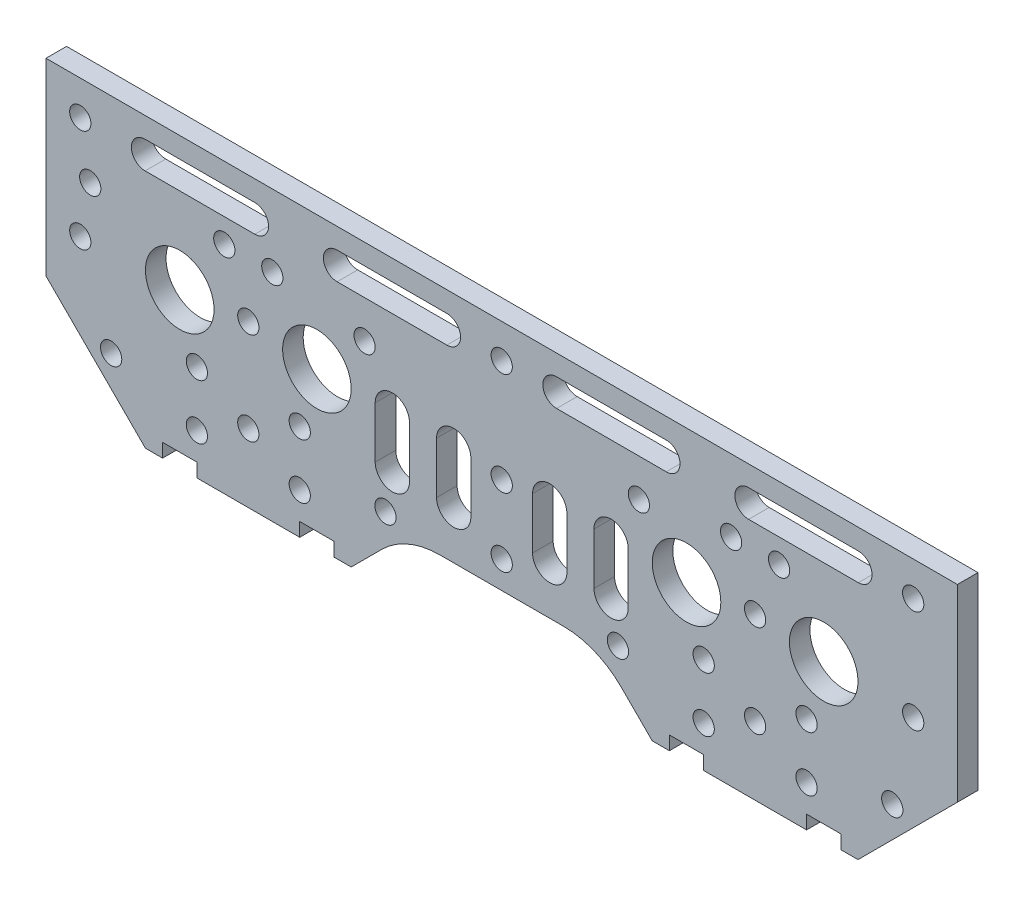
from build123d import *

# Parameters (mm, degrees)
SKETCH_1_R          = 1.55
SKETCH_1_R_2        = 5
EXTRUDE_1_DEPTH     = 3
FILLET_1_R          = 12
SKETCH_2_W          = 5
SKETCH_2_H          = 8
CUT_EXTRUDE_1_DEPTH = 10


with BuildPart() as part:
    # 草图1 → 凸台-拉伸1 (new body)
    with BuildSketch(Plane.XY):
        Polygon((-29.5, 32), (103.4, 32), (103.4, 7), (103.4, 4.5), (88.9, -10), (86.4, -10), (61.4, -10), (58.9, -10), (50.9, -2), (23, -2), (15, -10), (12.5, -10), (-12.5, -10), (-15, -10), (-29.5, 4.5), (-29.5, 7), align=None)
        with Locations((-7.5, 4)):
            Circle(SKETCH_1_R, mode=Mode.SUBTRACT)
        with Locations((-7.5, -4)):
            Circle(SKETCH_1_R, mode=Mode.SUBTRACT)
        with Locations((7.5, -4)):
            Circle(SKETCH_1_R, mode=Mode.SUBTRACT)
        with Locations((7.5, 4)):
            Circle(SKETCH_1_R, mode=Mode.SUBTRACT)
        with Locations((66.4, 4)):
            Circle(SKETCH_1_R, mode=Mode.SUBTRACT)
        with Locations((66.4, -4)):
            Circle(SKETCH_1_R, mode=Mode.SUBTRACT)
        with Locations((81.4, 4)):
            Circle(SKETCH_1_R, mode=Mode.SUBTRACT)
        with Locations((81.4, -4)):
            Circle(SKETCH_1_R, mode=Mode.SUBTRACT)
        with Locations((-24.5, 27)):
            Circle(SKETCH_1_R, mode=Mode.SUBTRACT)
        with Locations((-24.5, 12)):
            Circle(SKETCH_1_R, mode=Mode.SUBTRACT)
        with Locations((16.95, 19.5)):
            Circle(SKETCH_1_R, mode=Mode.SUBTRACT)
        with Locations((36.95, 27)):
            Circle(SKETCH_1_R, mode=Mode.SUBTRACT)
        with Locations((36.95, 12)):
            Circle(SKETCH_1_R, mode=Mode.SUBTRACT)
        with Locations((56.95, 19.5)):
            Circle(SKETCH_1_R, mode=Mode.SUBTRACT)
        with Locations((96.95, 27)):
            Circle(SKETCH_1_R, mode=Mode.SUBTRACT)
        with Locations((96.95, 12)):
            Circle(SKETCH_1_R, mode=Mode.SUBTRACT)
        with Locations((-23.05, 19.5)):
            Circle(SKETCH_1_R, mode=Mode.SUBTRACT)
        with Locations((36.95, 2)):
            Circle(SKETCH_1_R, mode=Mode.SUBTRACT)
        with Locations((73.9, 13.5)):
            Circle(SKETCH_1_R, mode=Mode.SUBTRACT)
        with Locations((70.4, 21.5)):
            Circle(SKETCH_1_R, mode=Mode.SUBTRACT)
        with Locations(Location((77.4, 21.5, 0), (0, 0, 180))):
            Circle(SKETCH_1_R, mode=Mode.SUBTRACT)
        with Locations((0, 13.5)):
            Circle(SKETCH_1_R, mode=Mode.SUBTRACT)
        with Locations((-3.5, 21.5)):
            Circle(SKETCH_1_R, mode=Mode.SUBTRACT)
        with Locations((3.5, 21.5)):
            Circle(SKETCH_1_R, mode=Mode.SUBTRACT)
        with Locations((-20, -0.5)):
            Circle(SKETCH_1_R, mode=Mode.SUBTRACT)
        with Locations(Location((93.9, -0.5, 0), (0, 0, 180))):
            Circle(SKETCH_1_R, mode=Mode.SUBTRACT)
        with Locations(Location((20, -0.5, 0), (0, 0, 180))):
            Circle(SKETCH_1_R, mode=Mode.SUBTRACT)
        with Locations((53.9, -0.5)):
            Circle(SKETCH_1_R, mode=Mode.SUBTRACT)
        Circle(SKETCH_1_R, mode=Mode.SUBTRACT)
        with Locations((73.9, 0)):
            Circle(SKETCH_1_R, mode=Mode.SUBTRACT)
        with Locations((-10, 12.5)):
            Circle(SKETCH_1_R_2, mode=Mode.SUBTRACT)
        with Locations(Location((83.9, 12.5, 0), (0, 0, 180))):
            Circle(SKETCH_1_R_2, mode=Mode.SUBTRACT)
        with Locations(Location((10, 12.5, 0), (0, 0, 180))):
            Circle(SKETCH_1_R_2, mode=Mode.SUBTRACT)
        with Locations((63.9, 12.5)):
            Circle(SKETCH_1_R_2, mode=Mode.SUBTRACT)
        with BuildLine():
            Line((-15.05, 29), (0.95, 29))
            ThreePointArc((0.95, 29), (2.95, 27), (0.95, 25))
            Line((0.95, 25), (-15.05, 25))
            ThreePointArc((-15.05, 25), (-17.05, 27), (-15.05, 29))
        make_face(mode=Mode.SUBTRACT)
        with BuildLine():
            Line((12.95, 29), (28.95, 29))
            ThreePointArc((28.95, 29), (30.95, 27), (28.95, 25))
            Line((28.95, 25), (12.95, 25))
            ThreePointArc((12.95, 25), (10.95, 27), (12.95, 29))
        make_face(mode=Mode.SUBTRACT)
        with BuildLine():
            Line((44.95, 29), (60.95, 29))
            ThreePointArc((60.95, 29), (62.95, 27), (60.95, 25))
            Line((60.95, 25), (44.95, 25))
            ThreePointArc((44.95, 25), (42.95, 27), (44.95, 29))
        make_face(mode=Mode.SUBTRACT)
        with BuildLine():
            Line((72.95, 29), (88.95, 29))
            ThreePointArc((88.95, 29), (90.95, 27), (88.95, 25))
            Line((88.95, 25), (72.95, 25))
            ThreePointArc((72.95, 25), (70.95, 27), (72.95, 29))
        make_face(mode=Mode.SUBTRACT)
        with BuildLine():
            Line((23.5, 12.5), (23.5, 5))
            ThreePointArc((23.5, 5), (21, 2.5), (18.5, 5))
            Line((18.5, 5), (18.5, 12.5))
            ThreePointArc((18.5, 12.5), (21, 15), (23.5, 12.5))
        make_face(mode=Mode.SUBTRACT)
        with BuildLine():
            Line((32.45, 12.5), (32.45, 5))
            ThreePointArc((32.45, 5), (29.95, 2.5), (27.45, 5))
            Line((27.45, 5), (27.45, 12.5))
            ThreePointArc((27.45, 12.5), (29.95, 15), (32.45, 12.5))
        make_face(mode=Mode.SUBTRACT)
        with BuildLine():
            Line((50.4, 12.5), (50.4, 5))
            ThreePointArc((50.4, 5), (52.9, 2.5), (55.4, 5))
            Line((55.4, 5), (55.4, 12.5))
            ThreePointArc((55.4, 12.5), (52.9, 15), (50.4, 12.5))
        make_face(mode=Mode.SUBTRACT)
        with BuildLine():
            Line((41.45, 12.5), (41.45, 5))
            ThreePointArc((41.45, 5), (43.95, 2.5), (46.45, 5))
            Line((46.45, 5), (46.45, 12.5))
            ThreePointArc((46.45, 12.5), (43.95, 15), (41.45, 12.5))
        make_face(mode=Mode.SUBTRACT)
    extrude(amount=EXTRUDE_1_DEPTH)

    # 圆角1
    fillet_1_edges = [part.edges().sort_by_distance(p)[0] for p in [
        (50.9, -2, 1.5),
        (23, -2, 1.5),
    ]]
    fillet(fillet_1_edges, radius=FILLET_1_R)

    # 草图2 → 切除-拉伸1 (cut)
    with BuildSketch(Plane.XY.offset(3)):
        with Locations((-10, -12)):
            Rectangle(SKETCH_2_W, SKETCH_2_H)
        with Locations((10, -12)):
            Rectangle(SKETCH_2_W, SKETCH_2_H)
        with Locations((83.9, -12)):
            Rectangle(SKETCH_2_W, SKETCH_2_H)
        with Locations((63.9, -12)):
            Rectangle(SKETCH_2_W, SKETCH_2_H)
    extrude(amount=-CUT_EXTRUDE_1_DEPTH, mode=Mode.SUBTRACT)


solid = part.part
